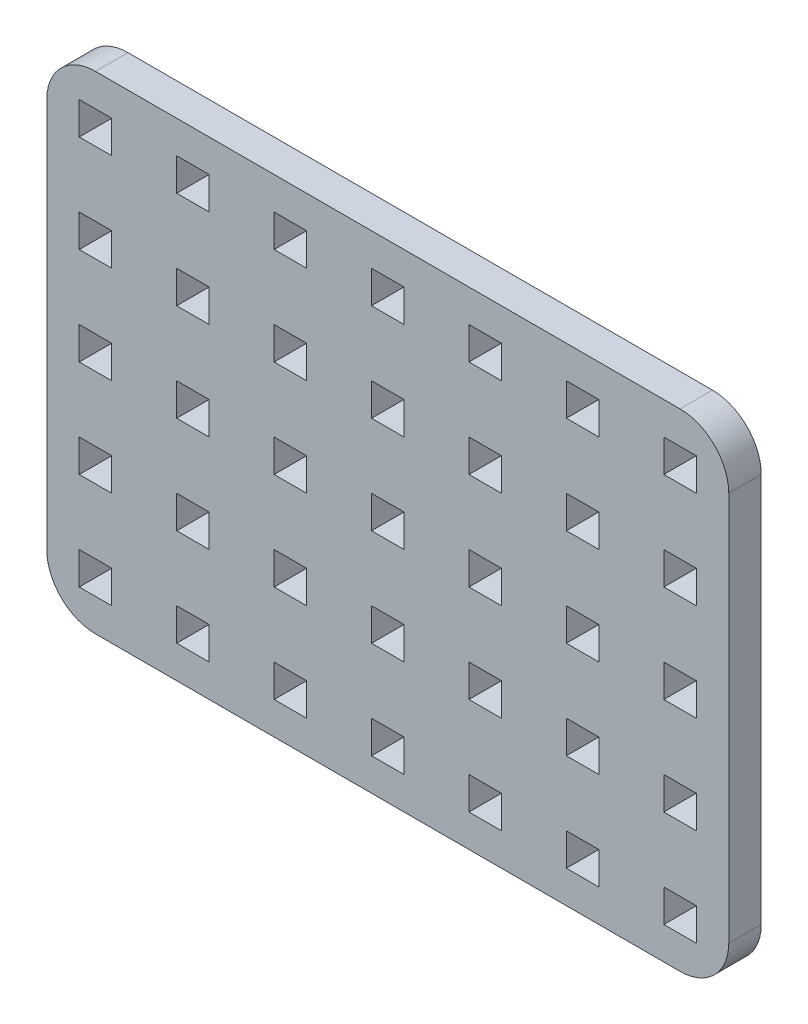
from build123d import *

# Parameters (mm, degrees)
MODEL_W                 = 3
MODEL_H                 = 3
SALIENTE_EXTRUIR1_DEPTH = 3


with BuildPart() as part:
    # Model → Saliente-Extruir1 (new body)
    with BuildSketch(Plane.XY):
        with BuildLine():
            Line((9.385930567, 298.549610222), (63.385930567, 298.549610222))
            ThreePointArc((63.385930567, 298.549610222), (66.567911083, 297.231590737), (67.885930567, 294.049610222))
            Line((67.885930567, 294.049610222), (67.885930567, 258.049610222))
            ThreePointArc((67.885930567, 258.049610222), (66.567911083, 254.867629706), (63.385930567, 253.549610222))
            Line((63.385930567, 253.549610222), (9.385930567, 253.549610222))
            ThreePointArc((9.385930567, 253.549610222), (6.203950052, 254.867629706), (4.885930567, 258.049610222))
            Line((4.885930567, 258.049610222), (4.885930567, 294.049610222))
            ThreePointArc((4.885930567, 294.049610222), (6.203950052, 297.231590737), (9.385930567, 298.549610222))
        make_face()
        with Locations((9.385930567, 294.049610222)):
            Rectangle(MODEL_W, MODEL_H, mode=Mode.SUBTRACT)
        with Locations((18.385930567, 294.049610222)):
            Rectangle(MODEL_W, MODEL_H, mode=Mode.SUBTRACT)
        with Locations((27.385930567, 294.049610222)):
            Rectangle(MODEL_W, MODEL_H, mode=Mode.SUBTRACT)
        with Locations((54.385930567, 294.049610222)):
            Rectangle(MODEL_W, MODEL_H, mode=Mode.SUBTRACT)
        with Locations((63.385930567, 294.049610222)):
            Rectangle(MODEL_W, MODEL_H, mode=Mode.SUBTRACT)
        with Locations((9.385930567, 258.049610222)):
            Rectangle(MODEL_W, MODEL_H, mode=Mode.SUBTRACT)
        with Locations((18.385930567, 258.049610222)):
            Rectangle(MODEL_W, MODEL_H, mode=Mode.SUBTRACT)
        with Locations((27.385930567, 258.049610222)):
            Rectangle(MODEL_W, MODEL_H, mode=Mode.SUBTRACT)
        with Locations((54.385930567, 258.049610222)):
            Rectangle(MODEL_W, MODEL_H, mode=Mode.SUBTRACT)
        with Locations((63.385930567, 258.049610222)):
            Rectangle(MODEL_W, MODEL_H, mode=Mode.SUBTRACT)
        with Locations((9.385930567, 267.049610222)):
            Rectangle(MODEL_W, MODEL_H, mode=Mode.SUBTRACT)
        with Locations((18.385930567, 267.049610222)):
            Rectangle(MODEL_W, MODEL_H, mode=Mode.SUBTRACT)
        with Locations((27.385930567, 267.049610222)):
            Rectangle(MODEL_W, MODEL_H, mode=Mode.SUBTRACT)
        with Locations((54.385930567, 267.049610222)):
            Rectangle(MODEL_W, MODEL_H, mode=Mode.SUBTRACT)
        with Locations((63.385930567, 267.049610222)):
            Rectangle(MODEL_W, MODEL_H, mode=Mode.SUBTRACT)
        with Locations((36.385930567, 294.049610222)):
            Rectangle(MODEL_W, MODEL_H, mode=Mode.SUBTRACT)
        with Locations((45.385930567, 294.049610222)):
            Rectangle(MODEL_W, MODEL_H, mode=Mode.SUBTRACT)
        with Locations((36.385930567, 258.049610222)):
            Rectangle(MODEL_W, MODEL_H, mode=Mode.SUBTRACT)
        with Locations((45.385930567, 258.049610222)):
            Rectangle(MODEL_W, MODEL_H, mode=Mode.SUBTRACT)
        with Locations((36.385930567, 267.049610222)):
            Rectangle(MODEL_W, MODEL_H, mode=Mode.SUBTRACT)
        with Locations((45.385930567, 267.049610222)):
            Rectangle(MODEL_W, MODEL_H, mode=Mode.SUBTRACT)
        with Locations((9.385930567, 276.049610222)):
            Rectangle(MODEL_W, MODEL_H, mode=Mode.SUBTRACT)
        with Locations((18.385930567, 276.049610222)):
            Rectangle(MODEL_W, MODEL_H, mode=Mode.SUBTRACT)
        with Locations((27.385930567, 276.049610222)):
            Rectangle(MODEL_W, MODEL_H, mode=Mode.SUBTRACT)
        with Locations((54.385930567, 276.049610222)):
            Rectangle(MODEL_W, MODEL_H, mode=Mode.SUBTRACT)
        with Locations((63.385930567, 276.049610222)):
            Rectangle(MODEL_W, MODEL_H, mode=Mode.SUBTRACT)
        with Locations((9.385930567, 285.049610222)):
            Rectangle(MODEL_W, MODEL_H, mode=Mode.SUBTRACT)
        with Locations((18.385930567, 285.049610222)):
            Rectangle(MODEL_W, MODEL_H, mode=Mode.SUBTRACT)
        with Locations((27.385930567, 285.049610222)):
            Rectangle(MODEL_W, MODEL_H, mode=Mode.SUBTRACT)
        with Locations((54.385930567, 285.049610222)):
            Rectangle(MODEL_W, MODEL_H, mode=Mode.SUBTRACT)
        with Locations((63.385930567, 285.049610222)):
            Rectangle(MODEL_W, MODEL_H, mode=Mode.SUBTRACT)
        with Locations((36.385930567, 276.049610222)):
            Rectangle(MODEL_W, MODEL_H, mode=Mode.SUBTRACT)
        with Locations((45.385930567, 276.049610222)):
            Rectangle(MODEL_W, MODEL_H, mode=Mode.SUBTRACT)
        with Locations((36.385930567, 285.049610222)):
            Rectangle(MODEL_W, MODEL_H, mode=Mode.SUBTRACT)
        with Locations((45.385930567, 285.049610222)):
            Rectangle(MODEL_W, MODEL_H, mode=Mode.SUBTRACT)
    extrude(amount=SALIENTE_EXTRUIR1_DEPTH)


solid = part.part
